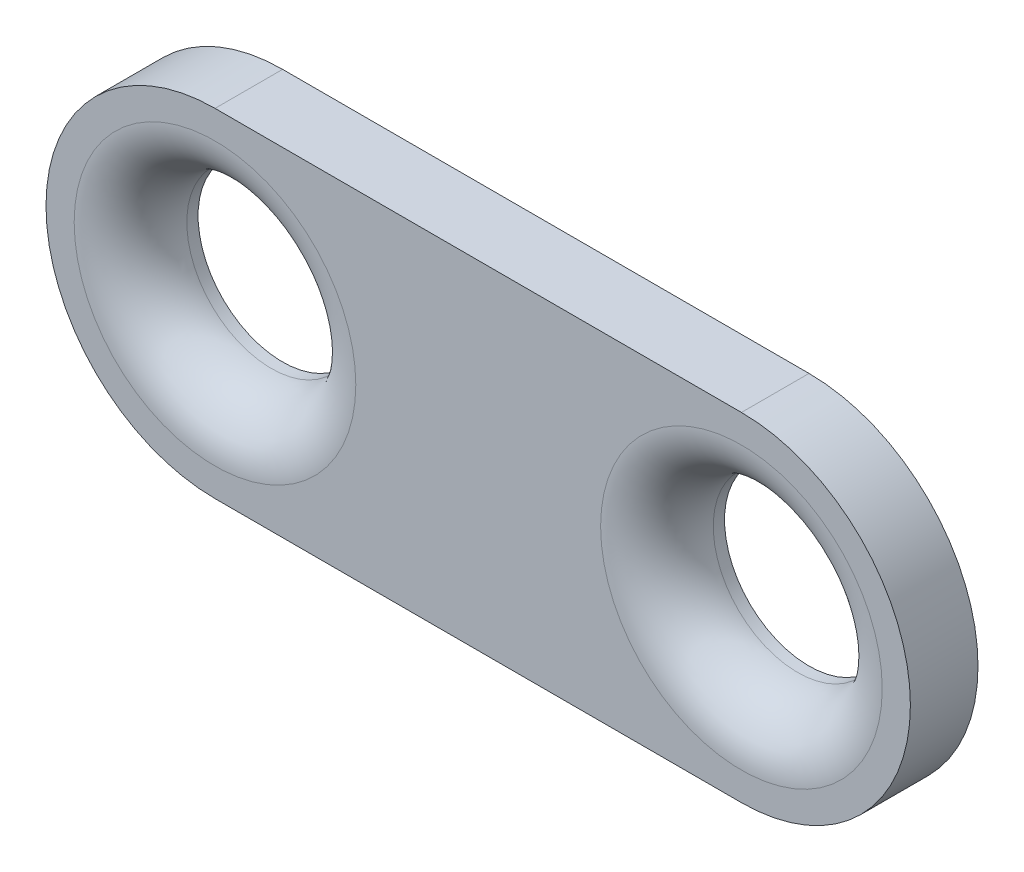
from build123d import *

# Parameters (mm, degrees)
SKETCH_1_R        = 3
SKETCH_1_R_2      = 1.5
EXTRUDE_1_DEPTH   = 1.2
EXTRUDE_1_2_DEPTH = 1.2
EXTRUDE_2_DEPTH   = 1.2
FILLET_1_R        = 1


with BuildPart() as part:
    # Эскиз1 → Бобышка-Вытянуть1 (new body)
    with BuildSketch(Plane.XY):
        with Locations((-4.672939719, 0.001012373)):
            Circle(SKETCH_1_R)
        with Locations((-4.672939719, 0.001012373)):
            Circle(SKETCH_1_R_2, mode=Mode.SUBTRACT)
    extrude(amount=EXTRUDE_1_DEPTH)



with BuildPart() as body_2:
    # Эскиз1 → Extrude 1 2 (new body)
    with BuildSketch(Plane.XY):
        with Locations((4.672939719, -0.001012373)):
            Circle(SKETCH_1_R)
        with Locations((4.672939719, -0.001012373)):
            Circle(SKETCH_1_R_2, mode=Mode.SUBTRACT)
    extrude(amount=EXTRUDE_1_2_DEPTH)


with BuildPart() as part_1:
    add(part.part)

    add(body_2.part)  # Бобышка-Вытянуть2 merges body 2
    # Эскиз2 → Бобышка-Вытянуть2 (add)
    with BuildSketch(Plane.XY.offset(1.2)):
        Polygon((-4.672103484, 3.001012257), (4.673403359, 2.998987591), (1.672939725, -0.001203708), (4.672476078, -3.001012337), (-4.673775953, -2.99898751), (-1.672939772, 0.001576302), align=None)
    extrude(amount=-EXTRUDE_2_DEPTH)

    # Скругление1
    fillet_1_edges = [part_1.edges().sort_by_distance(p)[0] for p in [
        (-6.172939719, 0.001012373, 1.2),
        (3.172939719, -0.001012373, 1.2),
    ]]
    fillet(fillet_1_edges, radius=FILLET_1_R)


solid = part_1.part
